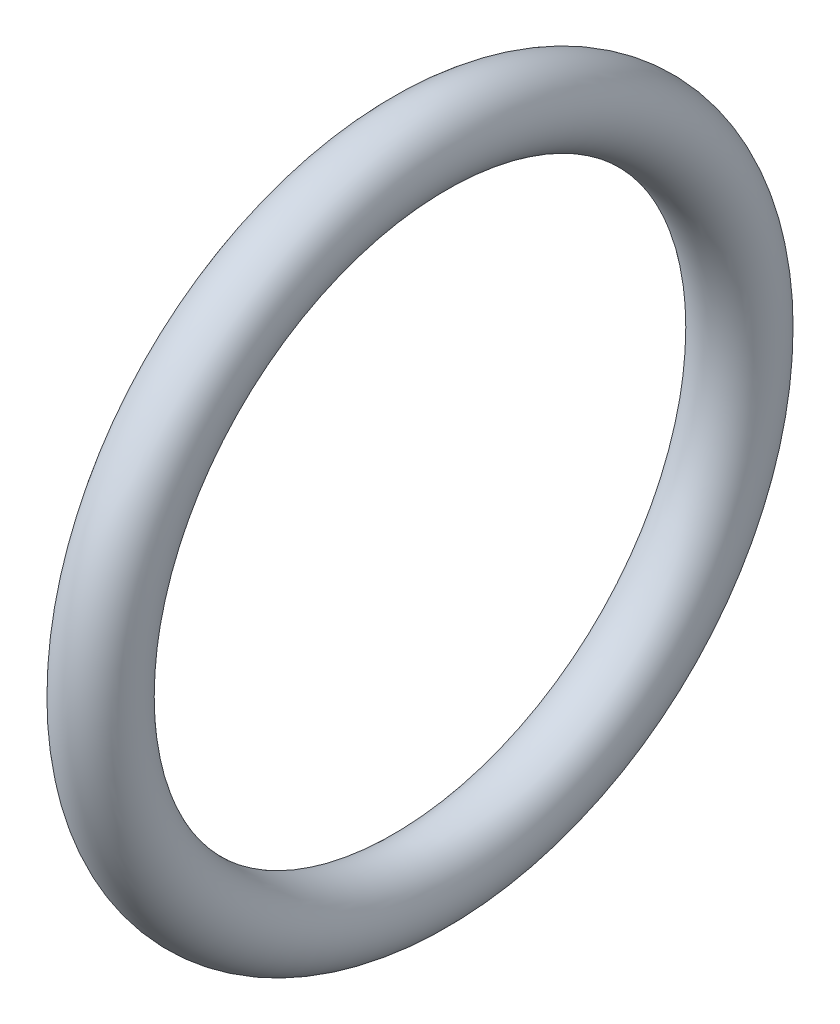
from build123d import *

# Parameters (mm, degrees)
SKETCH_1_R = 1.2


with BuildPart() as part:
    # 草图1 → 旋转1 (revolve)
    with BuildSketch(Plane.XY, mode=Mode.PRIVATE) as revolve_1_sk:
        with Locations((0, 10.1)):
            Circle(SKETCH_1_R)
    revolve(revolve_1_sk.sketch.rotate(Axis((0, 0, 0), (1, 0, 0)), 90), axis=Axis((0, 0, 0), (1, 0, 0)))


solid = part.part
